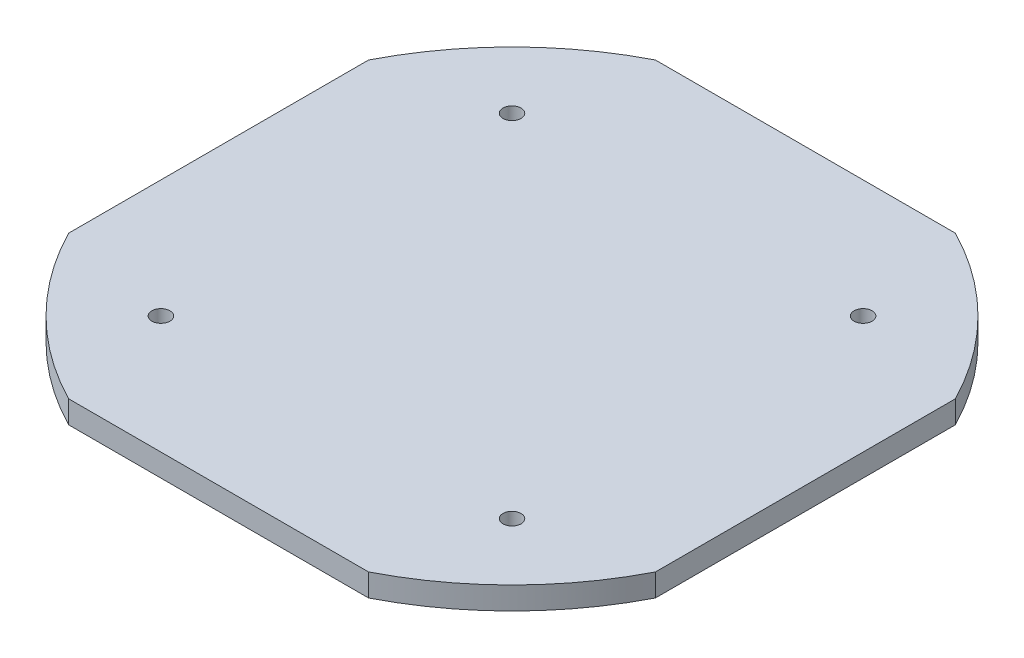
from build123d import *

# Parameters (mm, degrees)
BOSS_EXTRUDE1_DEPTH   = 5
F_4_0MM_DOWEL_HOLE2_D = 4


with BuildPart() as part:
    # Sketch1 → Boss-Extrude1 (new body)
    with BuildSketch(Plane(origin=(0, 0, 0), x_dir=(1, 0, 0), z_dir=(0, 1, 0))):
        with BuildLine():
            Line((65, 33.226495452), (65, -33.226495452))
            ThreePointArc((65, -33.226495452), (51.618795027, -51.618795027), (33.226495452, -65))
            Line((33.226495452, -65), (-33.226495452, -65))
            ThreePointArc((-33.226495452, -65), (-51.618795027, -51.618795027), (-65, -33.226495452))
            Line((-65, -33.226495452), (-65, 33.226495452))
            ThreePointArc((-65, 33.226495452), (-51.618795027, 51.618795027), (-33.226495452, 65))
            Line((-33.226495452, 65), (33.226495452, 65))
            ThreePointArc((33.226495452, 65), (51.618795027, 51.618795027), (65, 33.226495452))
        make_face()
    extrude(amount=BOSS_EXTRUDE1_DEPTH)

    # Ø4.0mm Dowel Hole2 (through all)
    with Locations(Plane(origin=(0, 5, 0), x_dir=(1, 0, 0), z_dir=(0, 1, 0))):
        with Locations((38.890872965, 38.890872965), (38.890872965, -38.890872965), (-38.890872965, -38.890872965), (-38.890872965, 38.890872965)):
            Hole(F_4_0MM_DOWEL_HOLE2_D / 2)


solid = part.part
